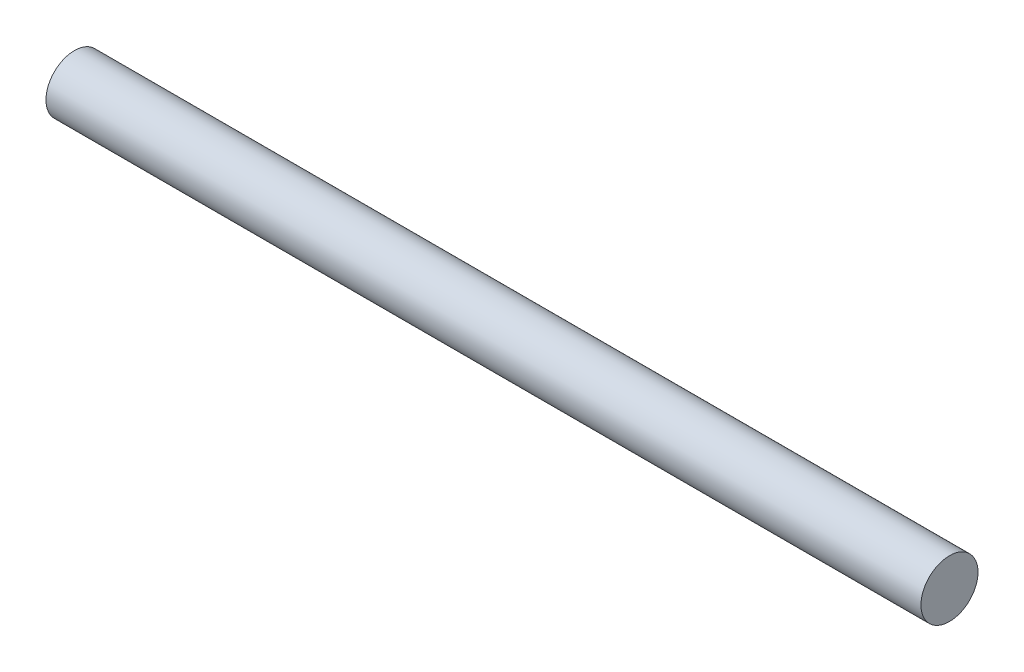
from build123d import *

# Parameters (mm, degrees)
SKETCH1_R           = 1.5
BOSS_EXTRUDE1_DEPTH = 46


with BuildPart() as part:
    # Sketch1 → Boss-Extrude1 (new body)
    with BuildSketch(Plane(origin=(0, 0, 0), x_dir=(0, 0, -1), z_dir=(1, 0, 0))):
        Circle(SKETCH1_R)
    extrude(amount=BOSS_EXTRUDE1_DEPTH)


solid = part.part
